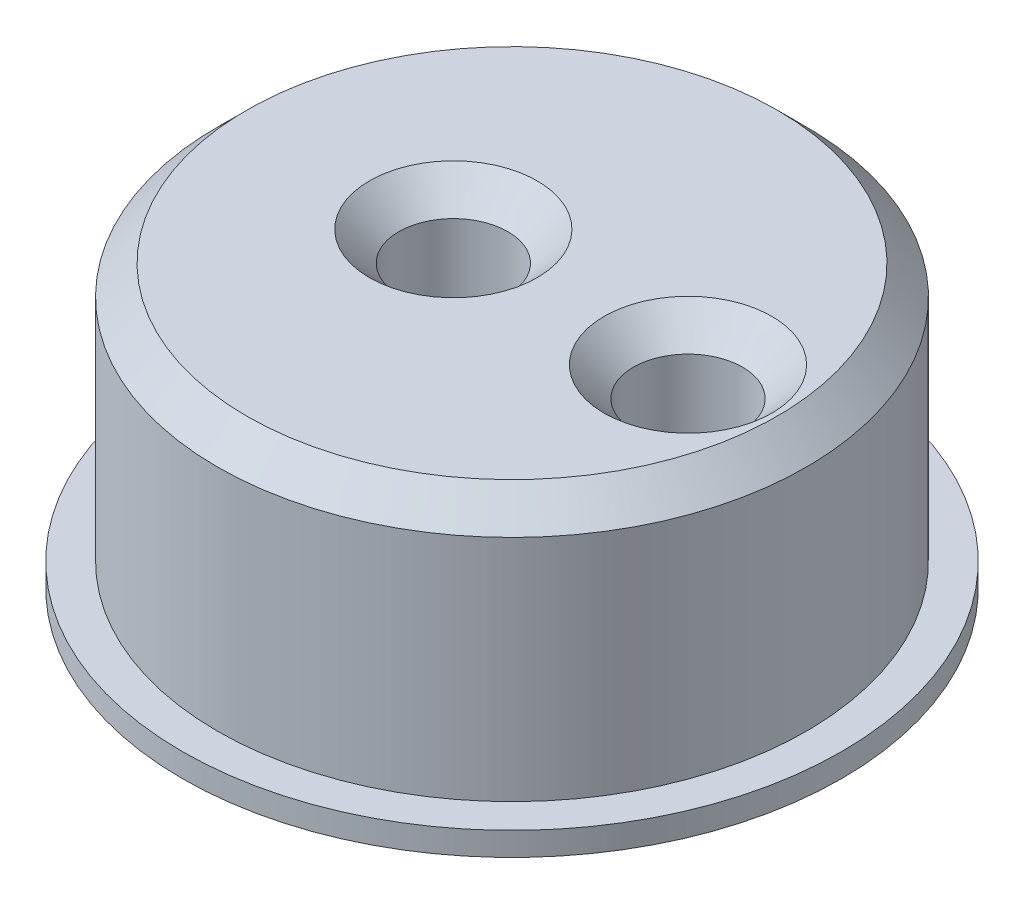
from build123d import *

# Parameters (mm, degrees)
SKETCH_1_R      = 5.02
SKETCH_1_R_2    = 0.93
EXTRUDE_1_DEPTH = 4.4
EXTRUDE_START   = 0.4
SKETCH_3_R      = 5.62
SKETCH_3_R_2    = 0.93
EXTRUDE_2_DEPTH = 0.4
CHAMFER_1_SIZE  = 0.5


with BuildPart() as part:
    # 草图1 → 凸台-拉伸1 (new body)
    with BuildSketch(Plane(origin=(0, 0, 0), x_dir=(1, 0, 0), z_dir=(0, 1, 0))):
        Circle(SKETCH_1_R)
        with Locations((3, 0)):
            Circle(SKETCH_1_R_2, mode=Mode.SUBTRACT)
        with Locations((-1, 0)):
            Circle(SKETCH_1_R_2, mode=Mode.SUBTRACT)
    extrude(amount=EXTRUDE_1_DEPTH)

    # 草图3 → 凸台-拉伸2 (add)
    with BuildSketch(Plane.XZ.offset(EXTRUDE_START)):
        Circle(SKETCH_3_R)
        with Locations((3, 0)):
            Circle(SKETCH_3_R_2, mode=Mode.SUBTRACT)
        with Locations((-1, 0)):
            Circle(SKETCH_3_R_2, mode=Mode.SUBTRACT)
    extrude(amount=-EXTRUDE_2_DEPTH)

    # 倒角1
    chamfer_1_edges = [part.edges().sort_by_distance(p)[0] for p in [
        (-5.02, 4.4, 0),
        (-1.93, 4.4, 0),
        (2.07, 4.4, 0),
        (-1.93, -0.4, 0),
        (2.07, -0.4, 0),
    ]]
    chamfer(chamfer_1_edges, length=CHAMFER_1_SIZE)


solid = part.part
